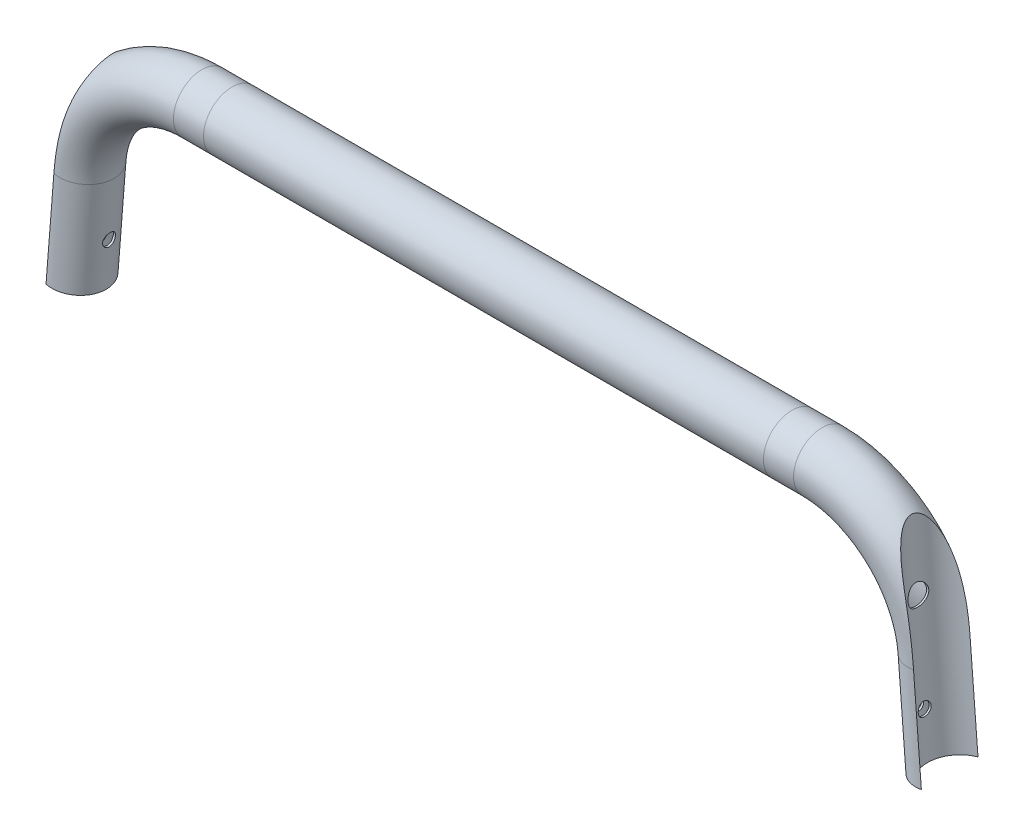
from build123d import *

# Parameters (mm, degrees)
SKETCH2_R               = 11
SKETCH2_R_2             = 10.2
SKETCH3_R               = 11.23581799789534
CUT_EXTRUDE1_DEPTH      = 213.9802077539031
BOSS_EXTRUDE1_REACH     = 206.639
CUT_EXTRUDE2_REACH      = 350.607
CUT_EXTRUDE2_END_RADIUS = 10.999999999999984
SKETCH8_R               = 2.4999999999999996
CUT_EXTRUDE3_REACH      = 350.607
CUT_EXTRUDE3_END_RADIUS = 12.03581799789538
SKETCH9_R               = 4.000000000000001


with BuildPart() as part:
    # Sweep1: sweep along a path in Sketch1
    with BuildLine(Plane.XY) as sweep1_path:
        Line((-167.5, -80), (-164.46757134740213, -41.46934069224712))
        ThreePointArc((-164.46757134740213, -41.46934069224712), (-150.15232487839378, -11.95548707539421), (-119.60629132941136, 0))
        Line((-119.60629132941136, 0), (-108, 0))
        Line((-108, 0), (108, 3.968e-14))
        Line((108, 3.968e-14), (119.60629132941136, 0))
        ThreePointArc((119.60629132941136, 0), (150.15232487839378, -11.955487075394203), (164.46757134740213, -41.46934069224713))
        Line((164.46757134740213, -41.46934069224713), (167.5, -80))
    # Sketch2 → Sweep1 (sweep)
    with BuildSketch(Plane(origin=(-167.49999999999997, -80, 0), x_dir=(-0.9969173337331282, 0.07845909572784168, 0), z_dir=(-0.07845909572784168, -0.9969173337331282, 0))):
        Circle(SKETCH2_R)
        Circle(SKETCH2_R_2, mode=Mode.SUBTRACT)
    sweep(path=sweep1_path.line)

    # Sketch3 → Cut-Extrude1 (cut, through all)
    with BuildSketch(Plane(origin=(7.288480076766105, -92.60892007092433, 0), x_dir=(0.9969173337331282, 0.07845909572784168, 0), z_dir=(0.07845909572784168, -0.9969173337331282, 0))):
        with Locations((164.70692574207166, 0)):
            Circle(SKETCH3_R)
    cut_extrude1 = extrude(amount=-CUT_EXTRUDE1_DEPTH, mode=Mode.SUBTRACT)

    # Mirror1: Cut-Extrude1 across plane
    add(cut_extrude1.mirror(Plane(origin=(0, 0, 0), x_dir=(0, 0, 1), z_dir=(1, 0, 0))), mode=Mode.SUBTRACT)

    # Sketch6 → Boss-Extrude1 (add, up to next)
    with BuildSketch(Plane(origin=(7.288480076766107, -92.60892007092434, 0), x_dir=(0.9969173337331283, 0.07845909572784171, 0), z_dir=(0.07845909572784171, -0.9969173337331283, 0)), mode=Mode.PRIVATE) as boss_extrude1_sk1:
        with BuildLine():
            ThreePointArc((162.0514749818429, 10.917517453241373), (153.4711077441763, 1.38e-15), (162.0514749818429, -10.917517453241373))
            ThreePointArc((162.0514749818429, -10.917517453241373), (160.88891450308557, -10.998494446553313), (159.72431138226378, -10.956024325452129))
            ThreePointArc((159.72431138226378, -10.956024325452129), (152.67110774417628, 1.47e-15), (159.72431138226378, 10.956024325452129))
            ThreePointArc((159.72431138226378, 10.956024325452129), (160.88891450308557, 10.99849444655331), (162.0514749818429, 10.917517453241373))
        make_face()
    boss_extrude1_tool1 = extrude(boss_extrude1_sk1.sketch, amount=-BOSS_EXTRUDE1_REACH, mode=Mode.PRIVATE) - part.part
    boss_extrude1 = boss_extrude1_tool1.solids().sort_by_distance((160.048061, -80.58648, 0))[0]
    add(boss_extrude1)

    # Mirror2: Boss-Extrude1 across plane
    add(boss_extrude1.mirror(Plane(origin=(0, 0, 0), x_dir=(0, 0, 1), z_dir=(1, 0, 0))))

    # Cut-Extrude2: up to this cylinder (the profile starts inside it)
    cut_extrude2_end = Plane(origin=(166.14248582919112, -62.75114701344296, 0), z_dir=(0.0784590957278417, -0.9969173337331283, 0)) * Cylinder(CUT_EXTRUDE2_END_RADIUS, 724.214, mode=Mode.PRIVATE)
    # Sketch8 → Cut-Extrude2 (cut, up to the surface)
    with BuildSketch(Plane(origin=(167.5, -80.00000000000001, 0), x_dir=(7.6e-16, 6e-17, -1), z_dir=(0.9969173337331283, 0.0784590957278417, 0)), mode=Mode.PRIVATE) as cut_extrude2_sk1:
        with Locations(Location((0, 17.30218999047264, 0), (0, 0, 90))):
            Circle(SKETCH8_R)
    cut_extrude2_tool1 = extrude(cut_extrude2_sk1.sketch, amount=-CUT_EXTRUDE2_REACH, mode=Mode.PRIVATE) & cut_extrude2_end
    cut_extrude2 = cut_extrude2_tool1.solids().sort_by_distance((166.142486, -62.751147, 0))[0]
    add(cut_extrude2, mode=Mode.SUBTRACT)

    # Mirror3: Cut-Extrude2 across plane
    add(cut_extrude2.mirror(Plane(origin=(0, 0, 0), x_dir=(0, 0, 1), z_dir=(1, 0, 0))), mode=Mode.SUBTRACT)

    # Cut-Extrude3: up to this cylinder (the profile starts inside it)
    cut_extrude3_end = Plane(origin=(167.2458157561295, -25.788303583939708, 0), z_dir=(0.0784590957278417, -0.9969173337331282, 0)) * Cylinder(CUT_EXTRUDE3_END_RADIUS, 726.2856359957908, mode=Mode.PRIVATE)
    # Sketch9 → Cut-Extrude3 (cut, up to the surface)
    with BuildSketch(Plane(origin=(167.5, -80.00000000000001, 0), x_dir=(7.6e-16, 6e-17, -1), z_dir=(0.9969173337331283, 0.0784590957278417, 0)), mode=Mode.PRIVATE) as cut_extrude3_sk1:
        with Locations(Location((-1.2306e-13, 54.064522490532156, 0), (0, 0, 90))):
            Circle(SKETCH9_R)
    cut_extrude3_tool1 = extrude(cut_extrude3_sk1.sketch, amount=-CUT_EXTRUDE3_REACH, mode=Mode.PRIVATE) & cut_extrude3_end
    add(cut_extrude3_tool1.solids().sort_by_distance((163.258146, -26.10214, 0))[0], mode=Mode.SUBTRACT)


solid = part.part
